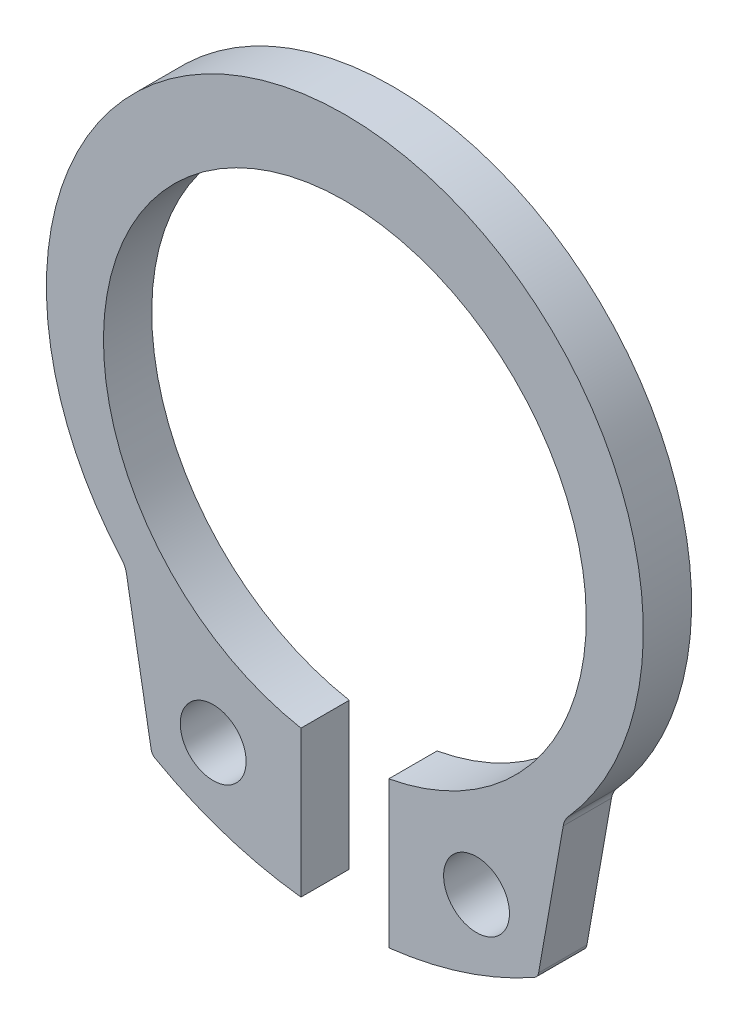
from build123d import *

# Parameters (mm, degrees)
SKETCH_1_R      = 0.75
EXTRUDE_1_DEPTH = 1.1


with BuildPart() as part:
    # 草图1 → 凸台-拉伸1 (new body)
    with BuildSketch(Plane.XY):
        with BuildLine():
            Line((-1, -9.142997198), (-1, -5.808326913))
            ThreePointArc((-1, -5.808326913), (-3.51781182, 3.827883631), (5.5, -0.4))
            ThreePointArc((5.5, -0.4), (4.227883631, -3.91781182), (1, -5.808326913))
            Line((1, -5.808326913), (1, -9.142997198))
            ThreePointArc((1, -9.142997198), (2.711468806, -8.771853852), (4.315554735, -8.069158189))
            ThreePointArc((4.315554735, -8.069158189), (4.380668311, -8.010477473), (4.414435496, -7.929588775))
            Line((4.414435496, -7.929588775), (4.975043576, -4.75022236))
            ThreePointArc((4.975043576, -4.75022236), (5.017096746, -4.619827111), (5.092964751, -4.505741898))
            ThreePointArc((5.092964751, -4.505741898), (0, 6.8), (-5.092964751, -4.505741898))
            ThreePointArc((-5.092964751, -4.505741898), (-5.017096746, -4.619827111), (-4.975043576, -4.75022236))
            Line((-4.975043576, -4.75022236), (-4.414435496, -7.929588775))
            ThreePointArc((-4.414435496, -7.929588775), (-4.380668311, -8.010477473), (-4.315554735, -8.069158189))
            ThreePointArc((-4.315554735, -8.069158189), (-2.711468806, -8.771853852), (-1, -9.142997198))
        make_face()
        with Locations((-3, -7.093477568)):
            Circle(SKETCH_1_R, mode=Mode.SUBTRACT)
        with Locations((3, -7.093477568)):
            Circle(SKETCH_1_R, mode=Mode.SUBTRACT)
    extrude(amount=EXTRUDE_1_DEPTH)


solid = part.part
